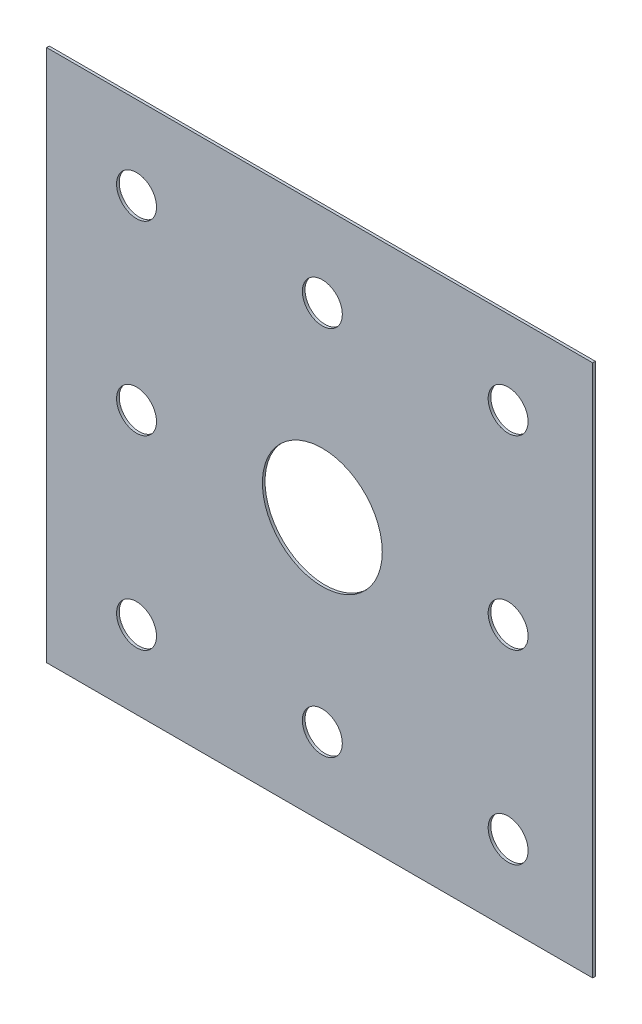
from build123d import *

# Parameters (mm, degrees)
SKETCH_1_W          = 41
SKETCH_1_H          = 40
EXTRUDE_1_DEPTH     = 0.2
SKETCH_5_R          = 4.5
CUT_EXTRUDE_3_DEPTH = 0.2
SKETCH_6_R          = 1.5
CUT_EXTRUDE_4_DEPTH = 0.2


with BuildPart() as part:
    # 스케치1 → 보스-돌출1 (new body)
    with BuildSketch(Plane.XY):
        with Locations((20.5, 20)):
            Rectangle(SKETCH_1_W, SKETCH_1_H)
    extrude(amount=EXTRUDE_1_DEPTH)

    # 스케치5 → 컷-돌출3 (cut)
    with BuildSketch(Plane.XY.offset(0.2)):
        with Locations((20.7, 19.8)):
            Circle(SKETCH_5_R)
    extrude(amount=-CUT_EXTRUDE_3_DEPTH, mode=Mode.SUBTRACT)

    # 스케치6 → 컷-돌출4 (cut)
    with BuildSketch(Plane.XY.offset(0.2)):
        with Locations((20.7, 33.75)):
            Circle(SKETCH_6_R)
        with Locations((34.65, 33.75)):
            Circle(SKETCH_6_R)
        with Locations((34.65, 19.8)):
            Circle(SKETCH_6_R)
        with Locations((20.7, 5.85)):
            Circle(SKETCH_6_R)
        with Locations((34.65, 5.85)):
            Circle(SKETCH_6_R)
        with Locations((6.75, 5.85)):
            Circle(SKETCH_6_R)
        with Locations((6.75, 33.75)):
            Circle(SKETCH_6_R)
        with Locations((6.75, 19.8)):
            Circle(SKETCH_6_R)
    extrude(amount=-CUT_EXTRUDE_4_DEPTH, mode=Mode.SUBTRACT)


solid = part.part
